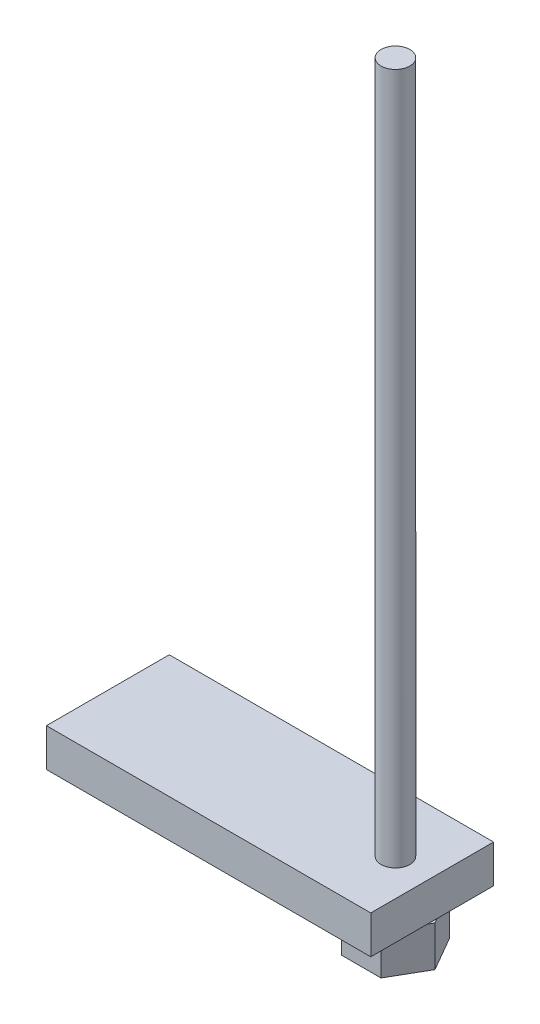
from build123d import *

# Parameters (mm, degrees)
SKETCH1_W           = 67.749
SKETCH1_H           = 25.656
BOSS_EXTRUDE1_DEPTH = 7.9375
SKETCH2_R           = 3
BOSS_EXTRUDE2_DEPTH = 144.4625
BOSS_EXTRUDE4_DEPTH = 8.448


with BuildPart() as part:
    # Sketch1 → Boss-Extrude1 (new body)
    with BuildSketch(Plane(origin=(0, 0, 0), x_dir=(1, 0, 0), z_dir=(0, 1, 0))):
        Rectangle(SKETCH1_W, SKETCH1_H)
    extrude(amount=BOSS_EXTRUDE1_DEPTH)

    # Sketch2 → Boss-Extrude2 (add)
    with BuildSketch(Plane(origin=(0, 7.9375, 0), x_dir=(1, 0, 0), z_dir=(0, 1, 0))):
        with Locations(Location((26.2085, 0, 0), (0, 0, 90))):
            Circle(SKETCH2_R)
    extrude(amount=BOSS_EXTRUDE2_DEPTH)

    # Sketch3 → Boss-Extrude4 (add)
    with BuildSketch(Plane.XZ):
        Polygon((22.0835, -7.144709581), (30.3335, -7.144709581), (34.4585, 0), (30.3335, 7.144709581), (22.0835, 7.144709581), (17.9585, 0), align=None)
    extrude(amount=BOSS_EXTRUDE4_DEPTH)


solid = part.part
